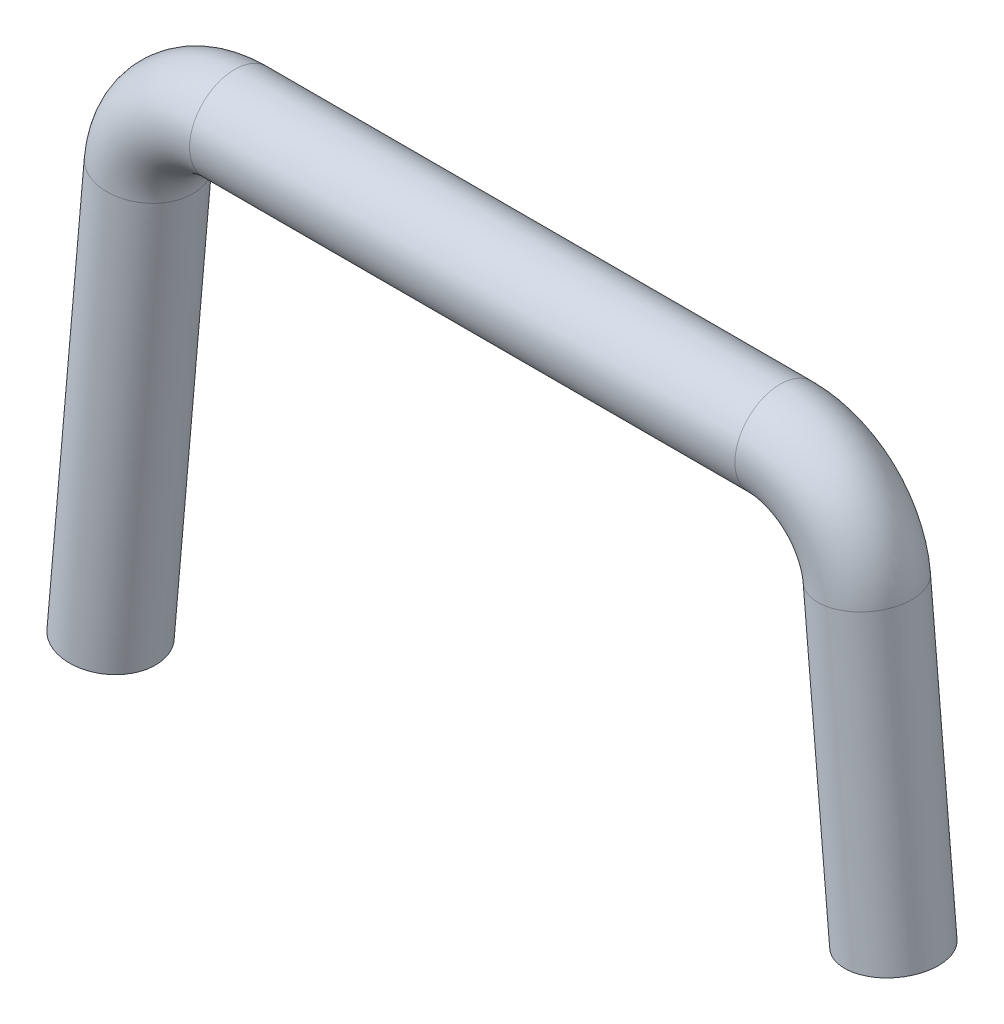
from build123d import *

# Parameters (mm, degrees)
PATH_R = 7


with BuildPart() as part:
    # Cam Handle: sweep along a path in Circle
    with BuildLine(Plane.XY) as cam_handle_path:
        Line((0, 0), (5.789702512, 66.176602527))
        ThreePointArc((5.789702512, 66.176602527), (10.117863133, 74.953244047), (19.238330936, 78.5))
        Line((19.238330936, 78.5), (103.782702537, 78.5))
        ThreePointArc((103.782702537, 78.5), (112.90317034, 74.953244047), (117.231330962, 66.176602527))
        Line((117.231330962, 66.176602527), (121.35, 19.1))
    # Path → Cam Handle (sweep)
    with BuildSketch(Plane(origin=(0, 0, 0), x_dir=(0.9961946980917455, -0.08715574274765839, 0), z_dir=(0.0871557427476584, 0.9961946980917457, 0))):
        Circle(PATH_R)
    sweep(path=cam_handle_path.line)


solid = part.part
